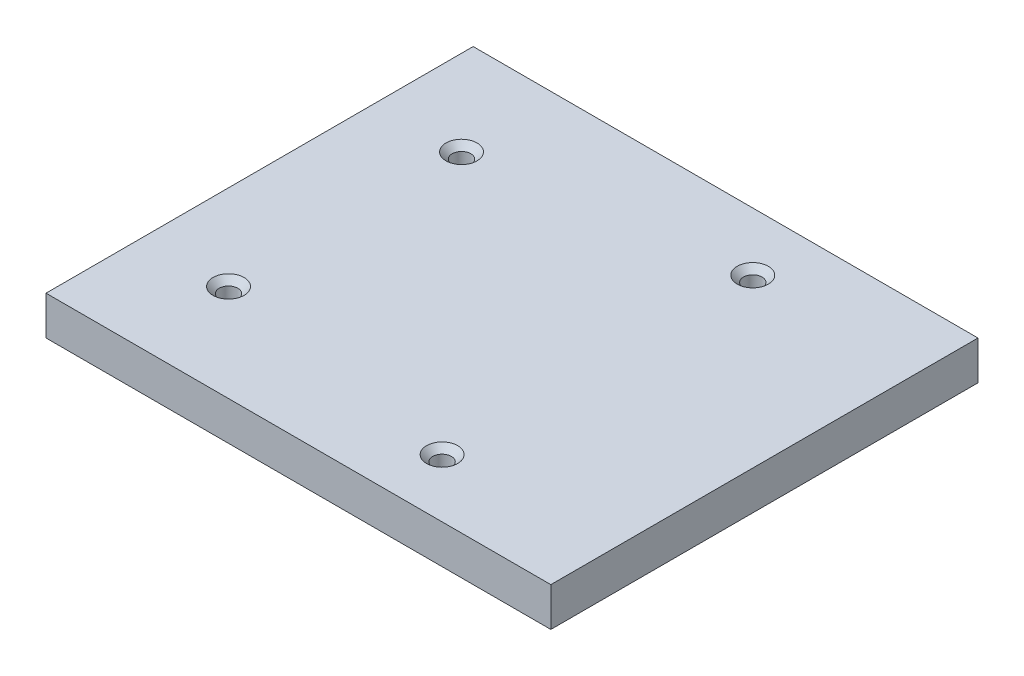
from build123d import *

# Parameters (mm, degrees)
SKETCH_2_W      = 130
SKETCH_2_H      = 110
SKETCH_2_R      = 2.4
EXTRUDE_1_DEPTH = 5
CHAMFER_1_SIZE  = 1.6


with BuildPart() as part:
    # Эскиз2 → Бобышка-Вытянуть1 (new, symmetric)
    with BuildSketch(Plane(origin=(0, 0, 0), x_dir=(1, 0, 0), z_dir=(0, 1, 0))):
        Rectangle(SKETCH_2_W, SKETCH_2_H)
        with Locations(Location((-43, 30, 0), (0, 0, 270))):
            Circle(SKETCH_2_R, mode=Mode.SUBTRACT)
        with Locations(Location((-43, -30, 0), (0, 0, 270))):
            Circle(SKETCH_2_R, mode=Mode.SUBTRACT)
        with Locations(Location((22, 40, 0), (0, 0, 270))):
            Circle(SKETCH_2_R, mode=Mode.SUBTRACT)
        with Locations(Location((22, -40, 0), (0, 0, 270))):
            Circle(SKETCH_2_R, mode=Mode.SUBTRACT)
    extrude(amount=EXTRUDE_1_DEPTH, both=True)

    # Фаска1
    chamfer_1_edges = [part.edges().sort_by_distance(p)[0] for p in [
        (-43, 5, -32.4),
        (-43, 5, 27.6),
        (22, 5, -42.4),
        (22, 5, 37.6),
    ]]
    chamfer(chamfer_1_edges, length=CHAMFER_1_SIZE)


solid = part.part
